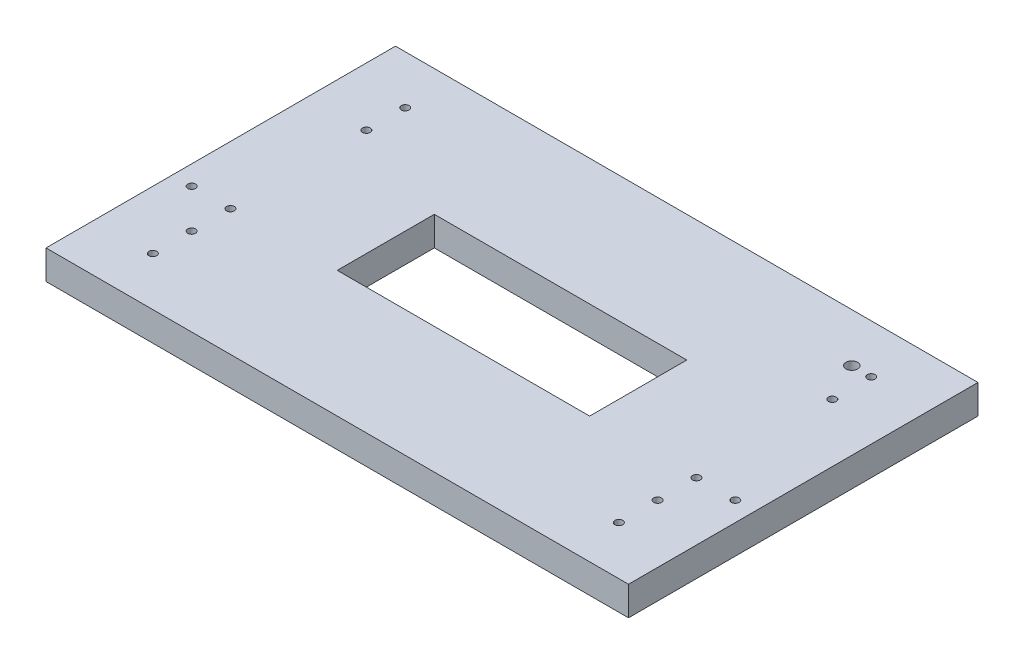
from build123d import *

# Parameters (mm, degrees)
CROQUIS1_W              = 300
CROQUIS1_H              = 180
SALIENTE_EXTRUIR1_DEPTH = 15
CROQUIS2_R              = 2
CORTAR_EXTRUIR1_DEPTH   = 10
CROQUIS3_R              = 3
CROQUIS3_W              = 130
CROQUIS3_H              = 50
CORTAR_EXTRUIR2_DEPTH   = 15
CROQUIS4_R              = 2
CORTAR_EXTRUIR3_DEPTH   = 10


with BuildPart() as part:
    # Croquis1 → Saliente-Extruir1 (new body)
    with BuildSketch(Plane(origin=(0, 0, 0), x_dir=(1, 0, 0), z_dir=(0, 1, 0))):
        Rectangle(CROQUIS1_W, CROQUIS1_H)
    extrude(amount=SALIENTE_EXTRUIR1_DEPTH)

    # Croquis2 → Cortar-Extruir1 (cut)
    with BuildSketch(Plane(origin=(0, 15, 0), x_dir=(1, 0, 0), z_dir=(0, 1, 0))):
        with Locations(Location((-120, -45, 0), (0, 0, 270))):
            Circle(CROQUIS2_R)
        with Locations(Location((-120, -65, 0), (0, 0, 270))):
            Circle(CROQUIS2_R)
        with Locations(Location((120, -45, 0), (0, 0, 270))):
            Circle(CROQUIS2_R)
        with Locations(Location((120, -65, 0), (0, 0, 270))):
            Circle(CROQUIS2_R)
        with Locations(Location((-140, -25, 0), (0, 0, 270))):
            Circle(CROQUIS2_R)
        with Locations(Location((-120, -25, 0), (0, 0, 270))):
            Circle(CROQUIS2_R)
        with Locations(Location((120, -25, 0), (0, 0, 270))):
            Circle(CROQUIS2_R)
        with Locations(Location((140, -25, 0), (0, 0, 270))):
            Circle(CROQUIS2_R)
        with Locations(Location((-120, 65, 0), (0, 0, 270))):
            Circle(CROQUIS2_R)
        with Locations(Location((-120, 45, 0), (0, 0, 270))):
            Circle(CROQUIS2_R)
        with Locations(Location((120, 45, 0), (0, 0, 270))):
            Circle(CROQUIS2_R)
        with Locations(Location((120, 65, 0), (0, 0, 270))):
            Circle(CROQUIS2_R)
    extrude(amount=-CORTAR_EXTRUIR1_DEPTH, mode=Mode.SUBTRACT)

    # Croquis3 → Cortar-Extruir2 (cut)
    with BuildSketch(Plane(origin=(0, 15, 0), x_dir=(1, 0, 0), z_dir=(0, 1, 0))):
        with Locations(Location((110, 65, 0), (0, 0, 270))):
            Circle(CROQUIS3_R)
        Rectangle(CROQUIS3_W, CROQUIS3_H)
    extrude(amount=-CORTAR_EXTRUIR2_DEPTH, mode=Mode.SUBTRACT)

    # Croquis4 → Cortar-Extruir3 (cut)
    with BuildSketch(Plane.XZ):
        with Locations(Location((140, -65, 0), (0, 0, 270))):
            Circle(CROQUIS4_R)
    extrude(amount=-CORTAR_EXTRUIR3_DEPTH, mode=Mode.SUBTRACT)


solid = part.part
